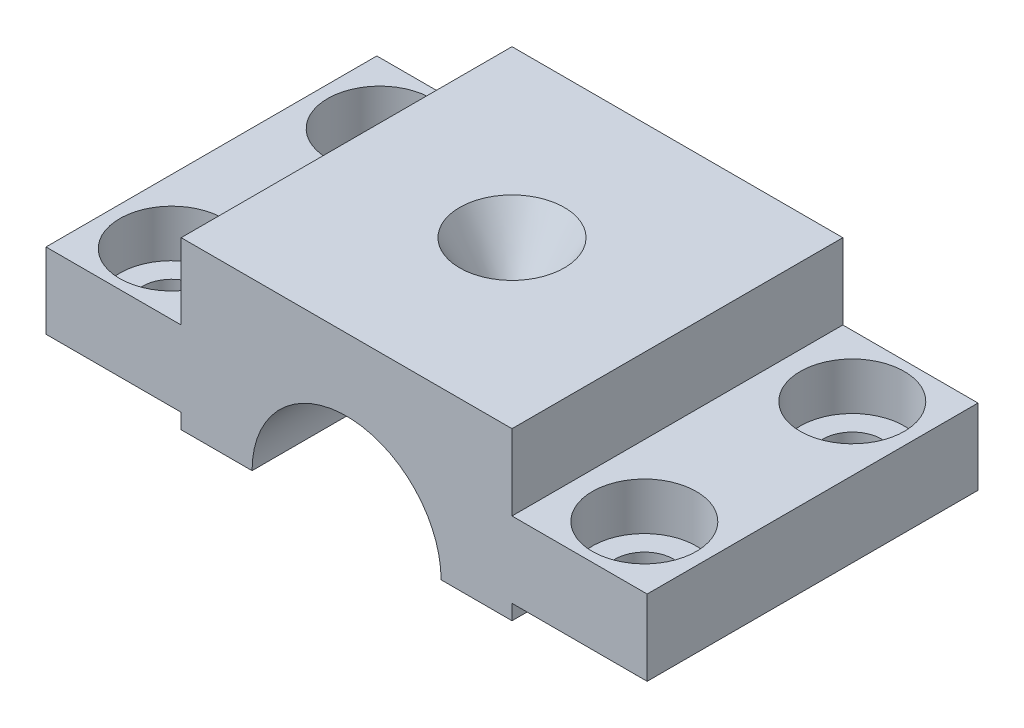
from build123d import *

# Parameters (mm, degrees)
SZKIC1_W                                          = 31.8
SZKIC1_H                                          = 8.8
DODANIE_WYCI_GNI_CIE1_DEPTH                       = 8.75
SZKIC2_W                                          = 7.15
SZKIC2_H                                          = 17.5
WYTNIJ_WYCI_GNI_CIE1_DEPTH                        = 0.8
SZKIC3_W                                          = 7.15
SZKIC3_H                                          = 4
WYTNIJ_WYCI_GNI_CIE2_DEPTH                        = 26.228951623
POG_BIENIE_WALCOWE_POD_M2_5_RUB_Z_BEM_D           = 3.1
POG_BIENIE_WALCOWE_POD_M2_5_RUB_Z_BEM_CBORE_D     = 5.5
POG_BIENIE_WALCOWE_POD_M2_5_RUB_Z_BEM_CBORE_DEPTH = 2.5
SZKIC6_R                                          = 5
WYTNIJ_WYCI_GNI_CIE3_DEPTH                        = 26.228951623


with BuildPart() as part:
    # Szkic1 → Dodanie-wyciągnięcie1 (new, symmetric)
    with BuildSketch(Plane.XY):
        with Locations((0, 4.4)):
            Rectangle(SZKIC1_W, SZKIC1_H)
    extrude(amount=DODANIE_WYCI_GNI_CIE1_DEPTH, both=True)

    # Szkic2 → Wytnij-wyciągnięcie1 (cut)
    with BuildSketch(Plane.XZ):
        with Locations((12.325, 0)):
            Rectangle(SZKIC2_W, SZKIC2_H)
    wytnij_wyci_gni_cie1 = extrude(amount=-WYTNIJ_WYCI_GNI_CIE1_DEPTH, mode=Mode.SUBTRACT)

    # Szkic3 → Wytnij-wyciągnięcie2 (cut, through all)
    with BuildSketch(Plane.XY.offset(8.75)):
        with Locations((12.325, 6.8)):
            Rectangle(SZKIC3_W, SZKIC3_H)
    wytnij_wyci_gni_cie2 = extrude(amount=-WYTNIJ_WYCI_GNI_CIE2_DEPTH, mode=Mode.SUBTRACT)

    # Pogłębienie walcowe pod M2.5 Śrubę z łbem walcowym z gniazdem1 (through all)
    with Locations(Plane(origin=(0, 4.8, 0), x_dir=(1, 0, 0), z_dir=(0, 1, 0))):
        with Locations((12.5, 5.5), (12.5, -5.5)):
            pog_bienie_walcowe_pod_m2_5_rub_z_bem = CounterBoreHole(POG_BIENIE_WALCOWE_POD_M2_5_RUB_Z_BEM_D / 2, POG_BIENIE_WALCOWE_POD_M2_5_RUB_Z_BEM_CBORE_D / 2, POG_BIENIE_WALCOWE_POD_M2_5_RUB_Z_BEM_CBORE_DEPTH)

    # Lustro1: Wytnij-wyciągnięcie1, Wytnij-wyciągnięcie2, Pogłębienie walcowe pod M2.5 Śrubę z łbem walcowym z gniazdem1 across plane
    add(wytnij_wyci_gni_cie1.mirror(Plane(origin=(0, 0, 0), x_dir=(0, 0, 1), z_dir=(1, 0, 0))), mode=Mode.SUBTRACT)
    add(wytnij_wyci_gni_cie2.mirror(Plane(origin=(0, 0, 0), x_dir=(0, 0, 1), z_dir=(1, 0, 0))), mode=Mode.SUBTRACT)
    add(pog_bienie_walcowe_pod_m2_5_rub_z_bem.mirror(Plane(origin=(0, 0, 0), x_dir=(0, 0, 1), z_dir=(1, 0, 0))), mode=Mode.SUBTRACT)

    # Szkic6 → Wytnij-wyciągnięcie3 (cut, through all)
    with BuildSketch(Plane.XY.offset(8.75)):
        Circle(SZKIC6_R)
    extrude(amount=-WYTNIJ_WYCI_GNI_CIE3_DEPTH, mode=Mode.SUBTRACT)

    # Szkic7 → Wycięcie-obrót5 (revolve, cut)
    with BuildSketch(Plane.XY, mode=Mode.PRIVATE) as wyci_cie_obr_t5_sk:
        Polygon((0, 0), (0, 8.8), (2.770725942, 8.8), (0.75, 5.3), (0.75, 0), align=None)
    revolve(wyci_cie_obr_t5_sk.sketch.rotate(Axis((0, 0, 0), (0, 1, 0)), 90), axis=Axis((0, 0, 0), (0, 1, 0)), mode=Mode.SUBTRACT)


solid = part.part
